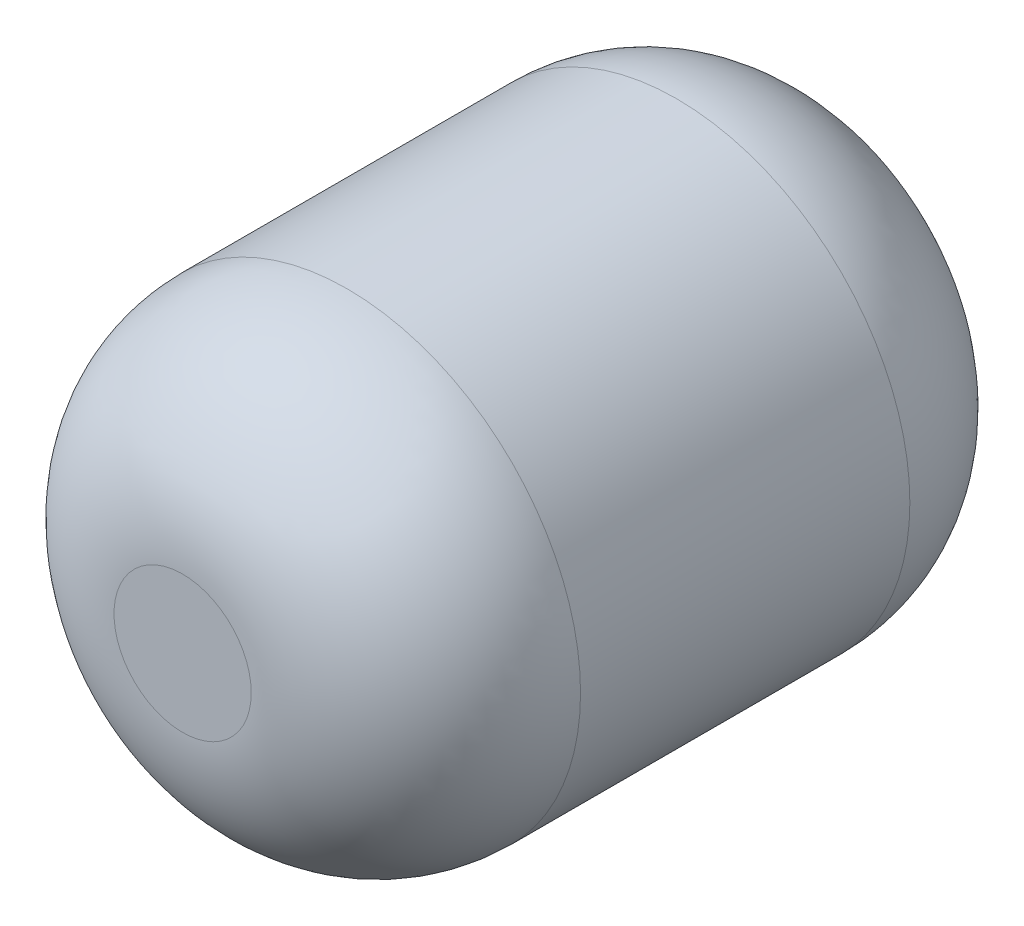
from build123d import *

# Parameters (mm, degrees)
SKETCH1_R           = 107.95
BOSS_EXTRUDE1_DEPTH = 304.8
FILLET1_R           = 76.2


with BuildPart() as part:
    # Sketch1 → Boss-Extrude1 (new body)
    with BuildSketch(Plane.XY):
        with Locations(Location((0, 0, 0), (0, 0, 180))):
            Circle(SKETCH1_R)
    extrude(amount=BOSS_EXTRUDE1_DEPTH)

    # Fillet1
    fillet1_edges = [part.edges().sort_by_distance(p)[0] for p in [
        (107.95, 0, 0),
        (107.95, 0, 304.8),
    ]]
    fillet(fillet1_edges, radius=FILLET1_R)


solid = part.part
